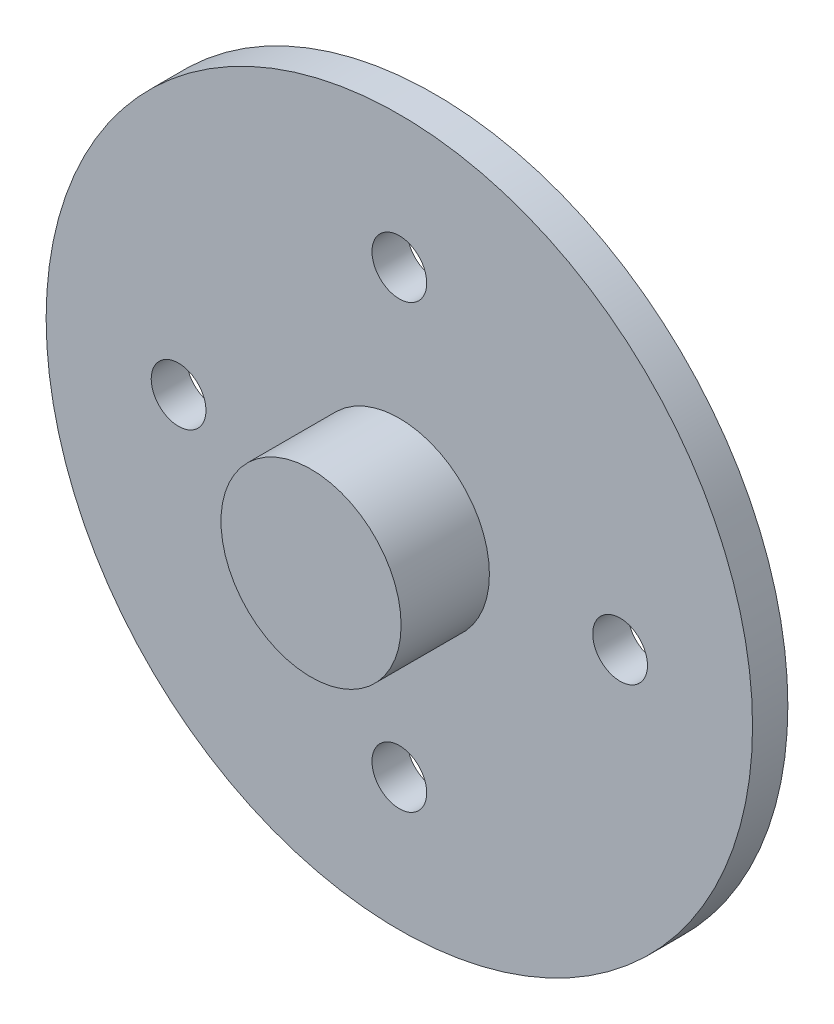
from build123d import *

# Parameters (mm, degrees)
ESBO_O1_R                = 20
RESSALTO_EXTRUS_O1_DEPTH = 2
ESBO_O2_R                = 5.1
RESSALTO_EXTRUS_O2_DEPTH = 5
ESBO_O3_R                = 1.55
CORTE_EXTRUS_O1_DEPTH    = 29.722813233
PADR_OCIRCULAR1_COUNT    = 4


with BuildPart() as part:
    # Esboço1 → Ressalto-extrusão1 (new body)
    with BuildSketch(Plane.XY):
        Circle(ESBO_O1_R)
    extrude(amount=RESSALTO_EXTRUS_O1_DEPTH)

    # Esboço2 → Ressalto-extrusão2 (add)
    with BuildSketch(Plane.XY.offset(2)):
        Circle(ESBO_O2_R)
    extrude(amount=RESSALTO_EXTRUS_O2_DEPTH)

    # Esboço3 → Corte-extrusão1 (cut, through all)
    with BuildSketch(Plane.XY.offset(2)):
        with Locations((12.5, 0)):
            Circle(ESBO_O3_R)
    corte_extrus_o1 = extrude(amount=-CORTE_EXTRUS_O1_DEPTH, mode=Mode.SUBTRACT)

    # PadrãoCircular1: Corte-extrusão1 ×4 about axis
    padr_ocircular1_axis = Axis((0, 0, 0), (0, 0, 1))
    for i in range(1, PADR_OCIRCULAR1_COUNT):
        add(corte_extrus_o1.rotate(padr_ocircular1_axis, i * 360 / PADR_OCIRCULAR1_COUNT), mode=Mode.SUBTRACT)


solid = part.part
